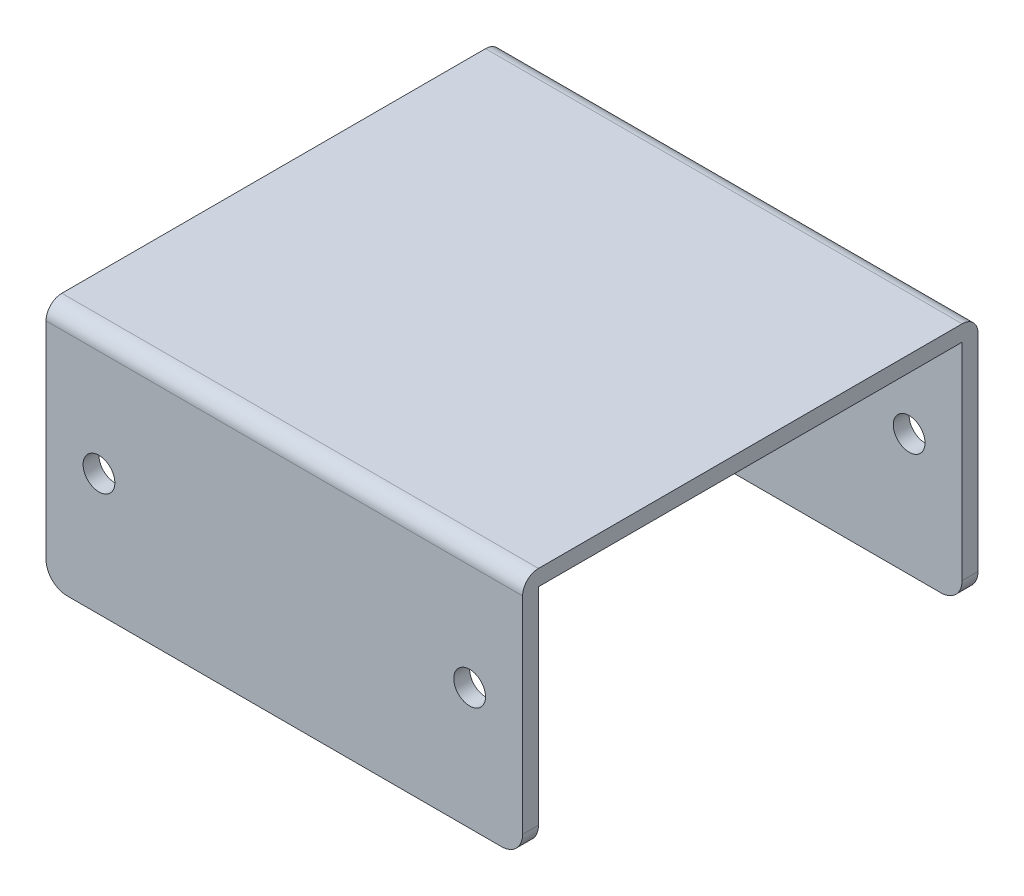
from build123d import *

# Parameters (mm, degrees)
SKETCH_1_W          = 45
SKETCH_1_H          = 43
EXTRUDE_1_DEPTH     = 23
SHELL_1_T           = -1.5
SKETCH_2_R          = 1.5
CUT_EXTRUDE_1_DEPTH = 54.7052139
FILLET_1_R          = 1.5
FILLET_2_R          = 2


with BuildPart() as part:
    # 草图1 → 凸台-拉伸1 (new body)
    with BuildSketch(Plane(origin=(0, 0, 0), x_dir=(1, 0, 0), z_dir=(0, 1, 0))):
        Rectangle(SKETCH_1_W, SKETCH_1_H)
    extrude(amount=EXTRUDE_1_DEPTH)

    # 抽壳1
    shell_1_openings = [part.faces().sort_by_distance(p)[0] for p in [
        (0, 0, 0),
        (22.5, 11.5, 0),
        (-22.5, 11.5, 0),
    ]]
    offset(amount=SHELL_1_T, openings=shell_1_openings, kind=Kind.INTERSECTION)

    # 草图2 → 切除-拉伸1 (cut, through all)
    with BuildSketch(Plane.XY.offset(21.5)):
        with Locations((-17.5, 11.5)):
            Circle(SKETCH_2_R)
        with Locations((17.5, 11.5)):
            Circle(SKETCH_2_R)
    extrude(amount=-CUT_EXTRUDE_1_DEPTH, mode=Mode.SUBTRACT)

    # 圆角1
    fillet_1_edges = [part.edges().sort_by_distance(p)[0] for p in [
        (0, 23, -21.5),
        (0, 23, 21.5),
    ]]
    fillet(fillet_1_edges, radius=FILLET_1_R)

    # 圆角2
    fillet_2_edges = [part.edges().sort_by_distance(p)[0] for p in [
        (-22.5, 0, 20.75),
        (22.5, 0, -20.75),
        (22.5, 0, 20.75),
        (-22.5, 0, -20.75),
    ]]
    fillet(fillet_2_edges, radius=FILLET_2_R)


solid = part.part
